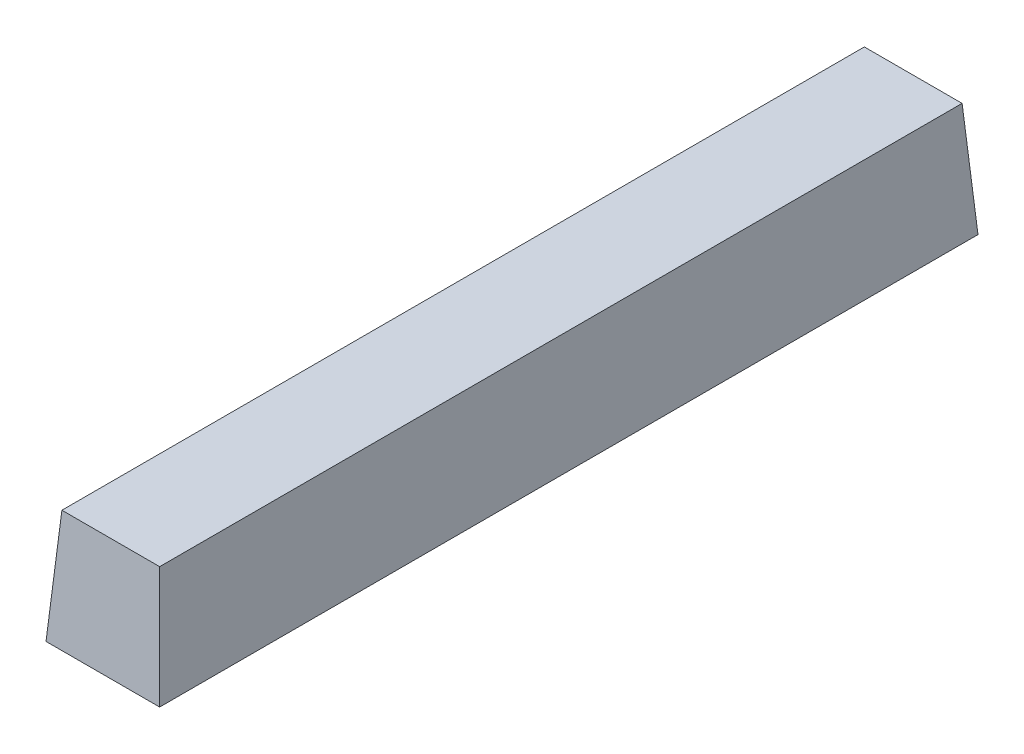
from build123d import *

# Parameters (mm, degrees)
SKETCH1_W           = 10
SKETCH1_H           = 72
BOSS_EXTRUDE1_DEPTH = 10
BOSS_EXTRUDE1_TAPER = 4


with BuildPart() as part:
    # Sketch1 → Boss-Extrude1 (new body)
    with BuildSketch(Plane(origin=(0, 0, 0), x_dir=(1, 0, 0), z_dir=(0, 1, 0))):
        with Locations((5, -36)):
            Rectangle(SKETCH1_W, SKETCH1_H)
    extrude(amount=BOSS_EXTRUDE1_DEPTH, taper=BOSS_EXTRUDE1_TAPER)


solid = part.part
